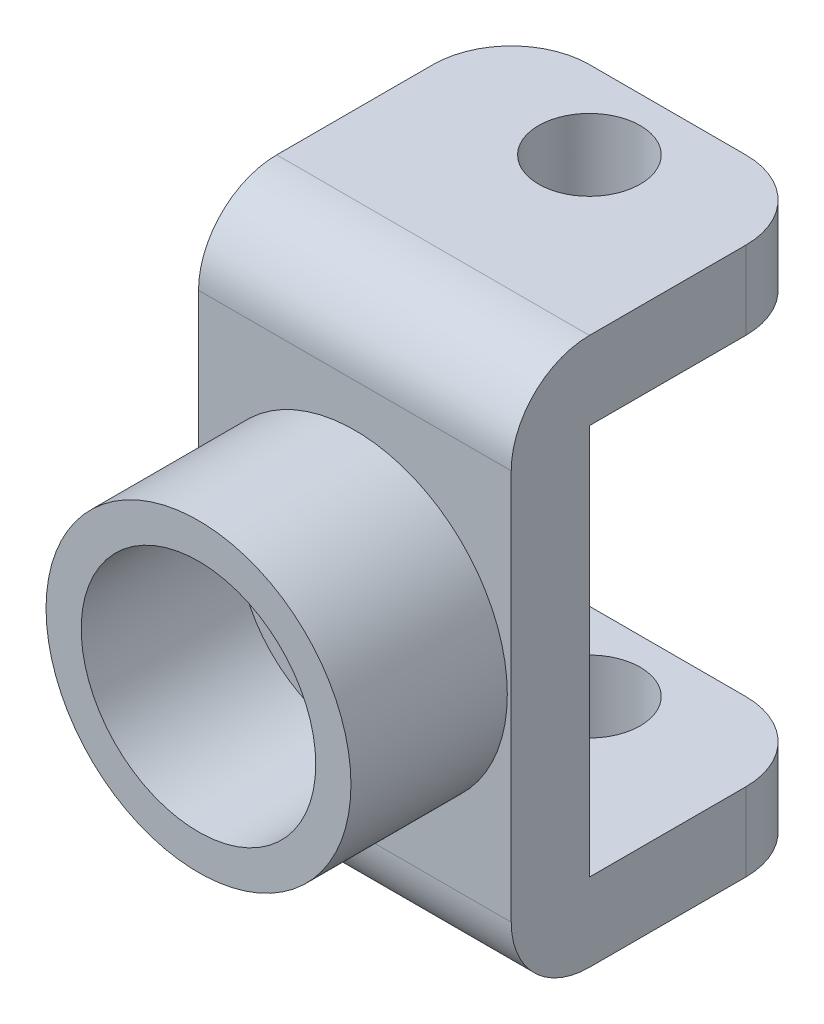
from build123d import *

# Parameters (mm, degrees)
SKETCH1_W           = 40
SKETCH1_H           = 50
BOSS_EXTRUDE1_DEPTH = 10
SKETCH3_W           = 40
SKETCH3_H           = 10
BOSS_EXTRUDE2_DEPTH = 20
FILLET1_R           = 10
SKETCH4_R           = 19.5
SKETCH4_R_2         = 15
BOSS_EXTRUDE3_DEPTH = 20
SKETCH5_R           = 6.5
CUT_EXTRUDE1_DEPTH  = 100


with BuildPart() as part:
    # Sketch1 → Boss-Extrude1 (new body)
    with BuildSketch(Plane.XY):
        Rectangle(SKETCH1_W, SKETCH1_H)
    extrude(amount=BOSS_EXTRUDE1_DEPTH)

    # Sketch3 → Boss-Extrude2 (add, symmetric)
    with BuildSketch(Plane(origin=(0, 0, 0), x_dir=(0, 0, -1), z_dir=(1, 0, 0))):
        with Locations((10, -30)):
            Rectangle(SKETCH3_W, SKETCH3_H)
        with Locations((10, 30)):
            Rectangle(SKETCH3_W, SKETCH3_H)
    extrude(amount=BOSS_EXTRUDE2_DEPTH, both=True)

    # Fillet1
    fillet1_edges = [part.edges().sort_by_distance(p)[0] for p in [
        (0, -35, 10),
        (-20, -30, -30),
        (20, -30, -30),
        (0, 35, 10),
        (-20, 30, -30),
        (20, 30, -30),
    ]]
    fillet(fillet1_edges, radius=FILLET1_R)

    # Sketch4 → Boss-Extrude3 (add)
    with BuildSketch(Plane.XY.offset(10)):
        Circle(SKETCH4_R)
        Circle(SKETCH4_R_2, mode=Mode.SUBTRACT)
    extrude(amount=BOSS_EXTRUDE3_DEPTH)

    # Sketch5 → Cut-Extrude1 (cut)
    with BuildSketch(Plane.XZ.offset(35)):
        with Locations(Location((0, -20, 0), (0, 0, 270))):
            Circle(SKETCH5_R)
    extrude(amount=-CUT_EXTRUDE1_DEPTH, mode=Mode.SUBTRACT)


solid = part.part
